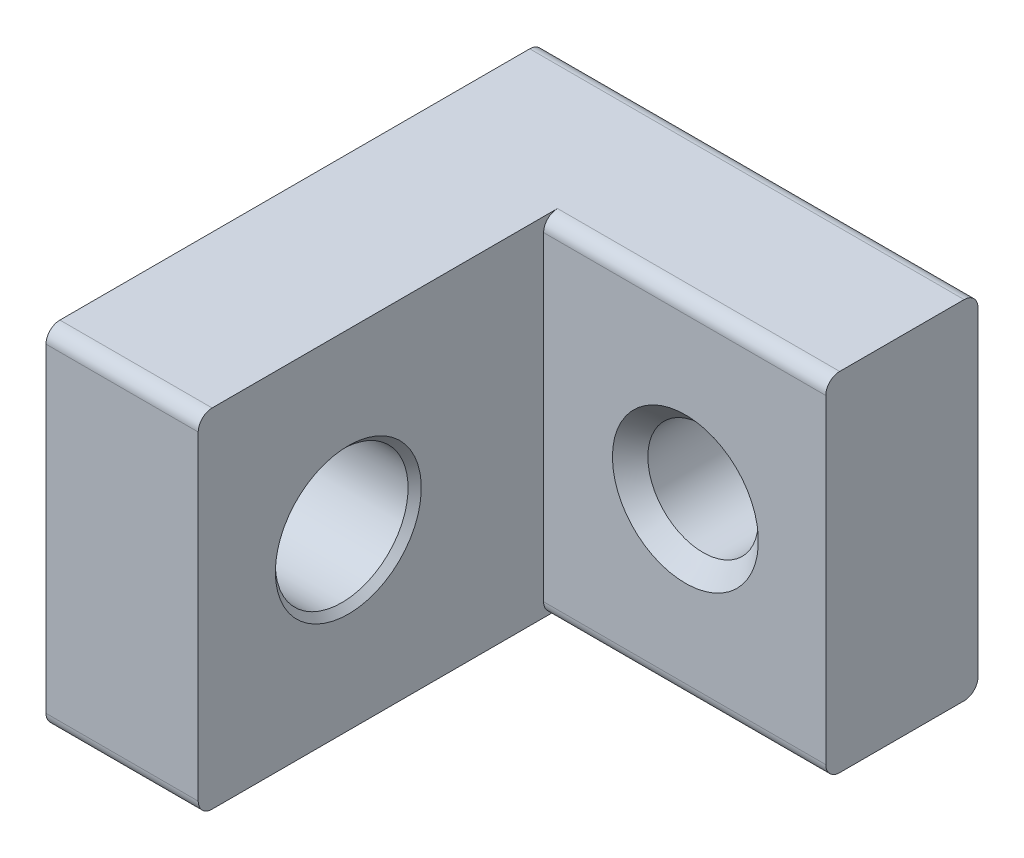
from build123d import *

# Parameters (mm, degrees)
EXTRUDE1_DEPTH = 6.35
FILLET1_R      = 0.508


with BuildPart() as part:
    # Sketch1 → Extrude1 (new, symmetric)
    with BuildSketch(Plane(origin=(0, 0, 0), x_dir=(1, 0, 0), z_dir=(0, 1, 0))):
        Polygon((5.9436, -18.1864), (5.9436, -5.5626), (16.256, -5.5626), (16.256, 0), (0.381, 0), (0.381, -18.1864), align=None)
    extrude(amount=EXTRUDE1_DEPTH, both=True)

    # Sketch2 → #11 (0.191) Diameter Hole1 (revolve, cut)
    with BuildSketch(Plane(origin=(0.381, 0, 12.7), x_dir=(0, 0, 1), z_dir=(0, 1, 0))):
        Polygon((0, 0), (0, 5.5626), (2.667, 5.5626), (2.4257, 5.3213), (2.4257, 0.2413), (2.667, 0), align=None)
    revolve(axis=Axis((-5.969, 0, 12.7), (1, 0, 0)), mode=Mode.SUBTRACT)

    # Sketch4 → #10-32 Tapped Hole1 (revolve, cut)
    with BuildSketch(Plane.YZ.offset(11.1252)):
        Polygon((0, 0), (0, 5.5626), (2.667, 5.5626), (2.0193, 4.9149), (2.0193, 0.6477), (2.667, 0), align=None)
    revolve(axis=Axis((11.1252, 0, -6.35), (0, 0, 1)), mode=Mode.SUBTRACT)

    # Fillet1
    fillet1_edges = [part.edges().sort_by_distance(p)[0] for p in [
        (11.0998, 6.35, 5.5626),
        (8.3185, 6.35, 0),
        (8.3185, -6.35, 0),
        (11.0998, -6.35, 5.5626),
        (3.1623, 6.35, 18.1864),
        (3.1623, -6.35, 18.1864),
    ]]
    fillet(fillet1_edges, radius=FILLET1_R)


solid = part.part
